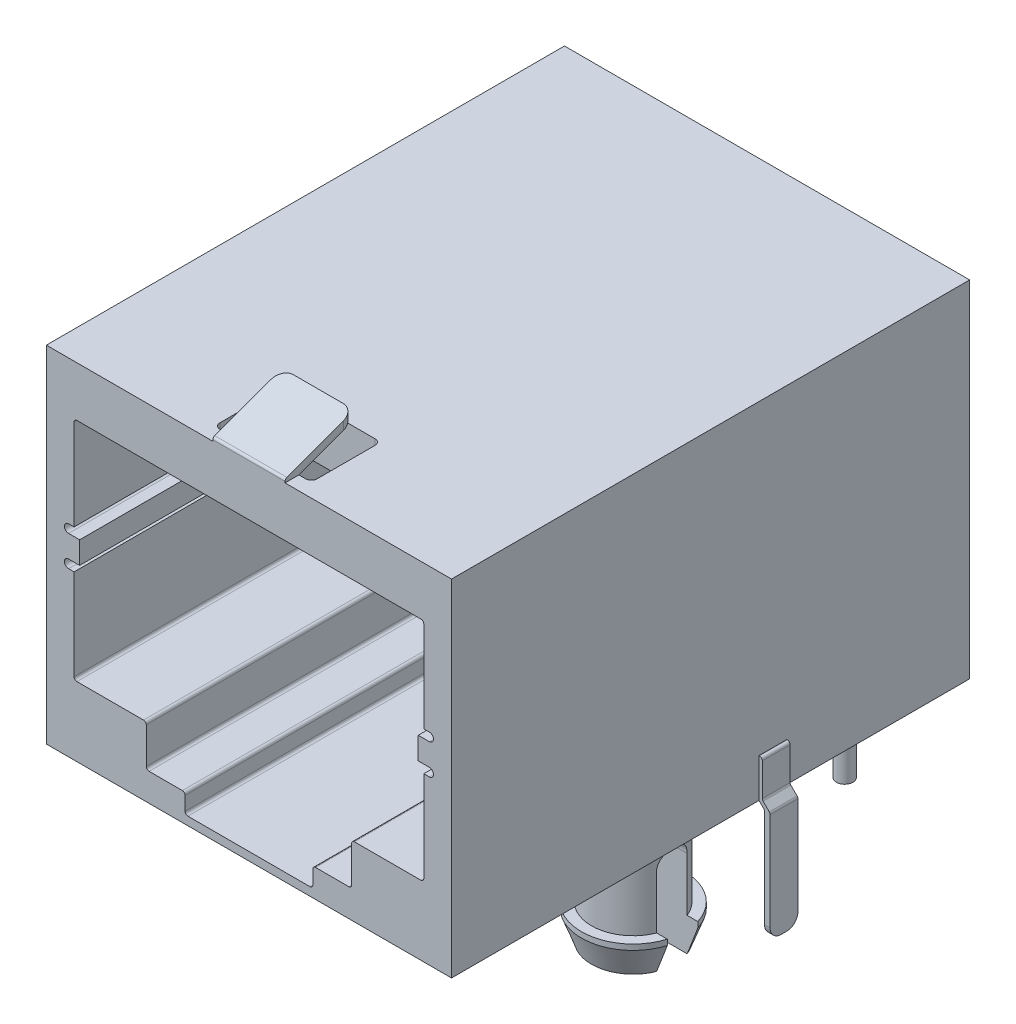
from build123d import *

# Parameters (mm, degrees)
RESSALTO_EXTRUS_O1_DEPTH           = 9.335
RESSALTO_EXTRUS_O1_DEPTH_BACK      = 9.335
ESBO_O1_W                          = 14.6
ESBO_O1_H                          = 12.45
CORTE_EXTRUS_O1_DEPTH              = 13
ESBO_O3_R                          = 1.5
ESBO_O3_R_2                        = 0.3
RESSALTO_EXTRUS_O2_DEPTH           = 3.68
ESBO_O4_R                          = 1.5
RESSALTO_EXTRUS_O3_DEPTH           = 1
RESSALTO_EXTRUS_O3_DRAFT           = 20
RESSALTO_EXTRUS_O3_PROFILE_2_DEPTH = 1
RESSALTO_EXTRUS_O3_PROFILE_2_DRAFT = 20
ESBO_O5_R                          = 1.863970234
RESSALTO_EXTRUS_O4_DEPTH           = 0.2
ESBO_O7_W                          = 1.3
ESBO_O7_H                          = 4.5
ESBO_O7_H_2                        = 0.866927726
RESSALTO_EXTRUS_O5_DEPTH           = 0.5
CORTE_EXTRUS_O2_DEPTH              = 22.822659788
CORTE_EXTRUS_O2_DEPTH_BACK         = 22.822659788
RESSALTO_EXTRUS_O6_DEPTH           = 0.5
RESSALTO_EXTRUS_O6_DEPTH_BACK      = 0.5
FILETE1_R                          = 0.4
ESBO_O11_W                         = 0.5
ESBO_O11_H                         = 4.075
RESSALTO_EXTRUS_O7_DEPTH           = 3
CHANFRO1_SIZE                      = 2
CORTE_EXTRUS_O3_REACH              = 22.567
RESSALTO_EXTRUS_O8_DEPTH           = 1.3
RESSALTO_EXTRUS_O8_DEPTH_BACK      = 1.3
FILETE2_R                          = 0.4


with BuildPart() as part:
    # Esboço1 → Ressalto-extrusão1 (new, two sides: drawn at the far end of the back side and taken through both)
    with BuildSketch(Plane.XY.offset(-RESSALTO_EXTRUS_O1_DEPTH_BACK)):
        with Locations((0, 6.725)):
            Rectangle(ESBO_O1_W, ESBO_O1_H)
    extrude(amount=RESSALTO_EXTRUS_O1_DEPTH + RESSALTO_EXTRUS_O1_DEPTH_BACK)

    # Esboço2 → Corte-extrusão1 (cut)
    with BuildSketch(Plane.XY.offset(9.335)):
        with BuildLine():
            Line((6.2, 11.15), (-6.2, 11.15))
            ThreePointArc((-6.2, 11.15), (-6.270710678, 11.120710678), (-6.3, 11.05))
            Line((-6.3, 11.05), (-6.3, 7.775))
            Line((-6.3, 7.775), (-6.5, 7.775))
            ThreePointArc((-6.5, 7.775), (-6.65, 7.625), (-6.5, 7.475))
            Line((-6.5, 7.475), (-6.1, 7.475))
            Line((-6.1, 7.475), (-6.1, 6.675))
            Line((-6.1, 6.675), (-6.5, 6.675))
            ThreePointArc((-6.5, 6.675), (-6.65, 6.525), (-6.5, 6.375))
            Line((-6.5, 6.375), (-6.3, 6.375))
            Line((-6.3, 6.375), (-6.3, 3.1))
            ThreePointArc((-6.3, 3.1), (-6.270710678, 3.029289322), (-6.2, 3))
            Line((-6.2, 3), (-3.8, 3))
            ThreePointArc((-3.8, 3), (-3.729289322, 2.970710678), (-3.7, 2.9))
            Line((-3.7, 2.9), (-3.7, 1.6))
            ThreePointArc((-3.7, 1.6), (-3.670710678, 1.529289322), (-3.6, 1.5))
            Line((-3.6, 1.5), (-2.4, 1.5))
            ThreePointArc((-2.4, 1.5), (-2.329289322, 1.470710678), (-2.3, 1.4))
            Line((-2.3, 1.4), (-2.3, 0.9))
            ThreePointArc((-2.3, 0.9), (-2.270710678, 0.829289322), (-2.2, 0.8))
            Line((-2.2, 0.8), (2.2, 0.8))
            ThreePointArc((2.2, 0.8), (2.270710678, 0.829289322), (2.3, 0.9))
            Line((2.3, 0.9), (2.3, 1.4))
            ThreePointArc((2.3, 1.4), (2.329289322, 1.470710678), (2.4, 1.5))
            Line((2.4, 1.5), (3.6, 1.5))
            ThreePointArc((3.6, 1.5), (3.670710678, 1.529289322), (3.7, 1.6))
            Line((3.7, 1.6), (3.7, 2.9))
            ThreePointArc((3.7, 2.9), (3.729289322, 2.970710678), (3.8, 3))
            Line((3.8, 3), (6.2, 3))
            ThreePointArc((6.2, 3), (6.270710678, 3.029289322), (6.3, 3.1))
            Line((6.3, 3.1), (6.3, 6.375))
            Line((6.3, 6.375), (6.5, 6.375))
            ThreePointArc((6.5, 6.375), (6.65, 6.525), (6.5, 6.675))
            Line((6.5, 6.675), (6.1, 6.675))
            Line((6.1, 6.675), (6.1, 7.475))
            Line((6.1, 7.475), (6.5, 7.475))
            ThreePointArc((6.5, 7.475), (6.65, 7.625), (6.5, 7.775))
            Line((6.5, 7.775), (6.3, 7.775))
            Line((6.3, 7.775), (6.3, 11.05))
            ThreePointArc((6.3, 11.05), (6.270710678, 11.120710678), (6.2, 11.15))
        make_face()
    extrude(amount=-CORTE_EXTRUS_O1_DEPTH, mode=Mode.SUBTRACT)

    # Esboço3 → Ressalto-extrusão2 (add)
    with BuildSketch(Plane.XZ.offset(-0.5)):
        with Locations((-5.715, 1.205)):
            Circle(ESBO_O3_R)
        with Locations((-4.445, -5.145)):
            Circle(ESBO_O3_R_2)
        with Locations((-3.175, -7.685)):
            Circle(ESBO_O3_R_2)
        with Locations((5.715, 1.205)):
            Circle(ESBO_O3_R)
        with Locations((-1.905, -5.145)):
            Circle(ESBO_O3_R_2)
        with Locations((-0.635, -7.685)):
            Circle(ESBO_O3_R_2)
        with Locations((0.635, -5.145)):
            Circle(ESBO_O3_R_2)
        with Locations((1.905, -7.685)):
            Circle(ESBO_O3_R_2)
        with Locations((3.175, -5.145)):
            Circle(ESBO_O3_R_2)
        with Locations((4.445, -7.685)):
            Circle(ESBO_O3_R_2)
    extrude(amount=RESSALTO_EXTRUS_O2_DEPTH)


with BuildPart() as ressalto_extrus_o3_tool:
    # Esboço4 → Ressalto-extrusão3 (with draft: the straight prism first)
    with BuildSketch(Plane.XZ.offset(3.18)):
        with Locations((-5.715, 1.205)):
            Circle(ESBO_O4_R)
    extrude(amount=-RESSALTO_EXTRUS_O3_DEPTH)
    # Ressalto-extrusão3: the draft: its side faces are tilted about the plane it starts from
    ressalto_extrus_o3_sides = [ressalto_extrus_o3_tool.faces().sort_by_distance(p)[0] for p in [
        (-7.215, -2.68, 1.205),
    ]]
    draft(ressalto_extrus_o3_sides, Plane.XZ.offset(3.18), RESSALTO_EXTRUS_O3_DRAFT)


with BuildPart() as part_1:
    add(part.part)

    # Ressalto-extrusão3: add ressalto_extrus_o3_tool
    add(ressalto_extrus_o3_tool.part)


with BuildPart() as ressalto_extrus_o3_profile_2_tool:
    # Esboço4 → Ressalto-extrusão3 profile 2 (with draft: the straight prism first)
    with BuildSketch(Plane.XZ.offset(3.18)):
        with Locations((5.715, 1.205)):
            Circle(ESBO_O4_R)
    extrude(amount=-RESSALTO_EXTRUS_O3_PROFILE_2_DEPTH)
    # Ressalto-extrusão3 profile 2: the draft: its side faces are tilted about the plane it starts from
    ressalto_extrus_o3_profile_2_sides = [ressalto_extrus_o3_profile_2_tool.faces().sort_by_distance(p)[0] for p in [
        (4.215, -2.68, 1.205),
    ]]
    draft(ressalto_extrus_o3_profile_2_sides, Plane.XZ.offset(3.18), RESSALTO_EXTRUS_O3_PROFILE_2_DRAFT)


with BuildPart() as part_2:
    add(part_1.part)

    # Ressalto-extrusão3 profile 2: add ressalto_extrus_o3_profile_2_tool
    add(ressalto_extrus_o3_profile_2_tool.part)

    # Esboço5 → Ressalto-extrusão4 (add)
    with BuildSketch(Plane(origin=(0, -2.18, 0), x_dir=(1, 0, 0), z_dir=(0, 1, 0))):
        with Locations((-5.715, -1.205)):
            Circle(ESBO_O5_R)
        with Locations((5.715, -1.205)):
            Circle(ESBO_O5_R)
    extrude(amount=RESSALTO_EXTRUS_O4_DEPTH)

    # Esboço7 → Ressalto-extrusão5 (add)
    with BuildSketch(Plane.XZ.offset(-0.5)):
        with Locations((-3.175, 4.902153743)):
            Rectangle(ESBO_O7_W, ESBO_O7_H)
        with Locations((-3.175, -8.712623651)):
            Rectangle(ESBO_O7_W, ESBO_O7_H_2)
        with Locations((3.175, -8.712623651)):
            Rectangle(ESBO_O7_W, ESBO_O7_H_2)
        with Locations((3.175, 4.902153743)):
            Rectangle(ESBO_O7_W, ESBO_O7_H)
    extrude(amount=RESSALTO_EXTRUS_O5_DEPTH)

    # Esboço8 → Corte-extrusão2 (cut, two sides: drawn at the far end of the back side and taken through both)
    with BuildSketch(Plane(origin=(7.3, 0, 0), x_dir=(0, 0, -1), z_dir=(1, 0, 0)).offset(-CORTE_EXTRUS_O2_DEPTH_BACK)):
        with BuildLine():
            Line((-1.755, -0.05), (-1.755, -3.18))
            Line((-1.755, -3.18), (-0.655, -3.18))
            Line((-0.655, -3.18), (-0.655, -0.05))
            ThreePointArc((-0.655, -0.05), (-1.205, 0.5), (-1.755, -0.05))
        make_face()
    extrude(amount=CORTE_EXTRUS_O2_DEPTH + CORTE_EXTRUS_O2_DEPTH_BACK, mode=Mode.SUBTRACT)

    # Esboço9 → Ressalto-extrusão6 (add, two sides: drawn at the far end of the back side and taken through both)
    with BuildSketch(Plane.XY.offset(-2.245).offset(-RESSALTO_EXTRUS_O6_DEPTH_BACK)):
        with BuildLine():
            Line((-7.3, 1.9), (-7.32, 1.9))
            ThreePointArc((-7.32, 1.9), (-7.390710678, 1.870710678), (-7.42, 1.8))
            Line((-7.42, 1.8), (-7.42, 0.621421356))
            ThreePointArc((-7.42, 0.621421356), (-7.427612047, 0.583153013), (-7.449289322, 0.550710678))
            Line((-7.449289322, 0.550710678), (-7.670710678, 0.329289322))
            ThreePointArc((-7.670710678, 0.329289322), (-7.692387953, 0.296846987), (-7.7, 0.258578644))
            Line((-7.7, 0.258578644), (-7.7, -3.68))
            Line((-7.7, -3.68), (-7.5, -3.68))
            Line((-7.5, -3.68), (-7.5, 0.258578644))
            ThreePointArc((-7.5, 0.258578644), (-7.492387953, 0.296846987), (-7.470710678, 0.329289322))
            Line((-7.470710678, 0.329289322), (-7.3, 0.5))
            Line((-7.3, 0.5), (-7.3, 1.9))
        make_face()
        with BuildLine():
            Line((7.3, 1.9), (7.3, 0.5))
            Line((7.3, 0.5), (7.470710678, 0.329289322))
            ThreePointArc((7.470710678, 0.329289322), (7.492387953, 0.296846987), (7.5, 0.258578644))
            Line((7.5, 0.258578644), (7.5, -3.68))
            Line((7.5, -3.68), (7.7, -3.68))
            Line((7.7, -3.68), (7.7, 0.258578644))
            ThreePointArc((7.7, 0.258578644), (7.692387953, 0.296846987), (7.670710678, 0.329289322))
            Line((7.670710678, 0.329289322), (7.449289322, 0.550710678))
            ThreePointArc((7.449289322, 0.550710678), (7.427612047, 0.583153013), (7.42, 0.621421356))
            Line((7.42, 0.621421356), (7.42, 1.8))
            ThreePointArc((7.42, 1.8), (7.390710678, 1.870710678), (7.32, 1.9))
            Line((7.32, 1.9), (7.3, 1.9))
        make_face()
    extrude(amount=RESSALTO_EXTRUS_O6_DEPTH + RESSALTO_EXTRUS_O6_DEPTH_BACK)

    # Filete1
    filete1_edges = [part_2.edges().sort_by_distance(p)[0] for p in [
        (-7.6, -3.68, -1.745),
        (-7.6, -3.68, -2.745),
        (7.6, -3.68, -2.745),
        (7.6, -3.68, -1.745),
    ]]
    fillet(filete1_edges, radius=FILETE1_R)

    # Esboço11 → Ressalto-extrusão7 (add)
    with BuildSketch(Plane.XY.offset(-3.665)):
        with Locations((-0.5, 9.1125)):
            Rectangle(ESBO_O11_W, ESBO_O11_H)
        with Locations((0.5, 9.1125)):
            Rectangle(ESBO_O11_W, ESBO_O11_H)
        with Locations((1.5, 9.1125)):
            Rectangle(ESBO_O11_W, ESBO_O11_H)
        with Locations((2.5, 9.1125)):
            Rectangle(ESBO_O11_W, ESBO_O11_H)
        with Locations((3.5, 9.1125)):
            Rectangle(ESBO_O11_W, ESBO_O11_H)
        with Locations((-1.5, 9.1125)):
            Rectangle(ESBO_O11_W, ESBO_O11_H)
        with Locations((-2.5, 9.1125)):
            Rectangle(ESBO_O11_W, ESBO_O11_H)
        with Locations((-3.5, 9.1125)):
            Rectangle(ESBO_O11_W, ESBO_O11_H)
    extrude(amount=RESSALTO_EXTRUS_O7_DEPTH)

    # Chanfro1
    chanfro1_edges = [part_2.edges().sort_by_distance(p)[0] for p in [
        (3.5, 7.075, -0.665),
        (2.5, 7.075, -0.665),
        (1.5, 7.075, -0.665),
        (0.5, 7.075, -0.665),
        (-0.5, 7.075, -0.665),
        (-1.5, 7.075, -0.665),
        (-2.5, 7.075, -0.665),
        (-3.5, 7.075, -0.665),
    ]]
    chamfer(chanfro1_edges, length=CHANFRO1_SIZE)

    # Esboço12 → Corte-extrusão3 (cut, up to next)
    with BuildSketch(Plane(origin=(0, 12.95, 0), x_dir=(1, 0, 0), z_dir=(0, 1, 0)), mode=Mode.PRIVATE) as corte_extrus_o3_sk1:
        with BuildLine():
            Line((-1.55, -6.335), (1.55, -6.335))
            ThreePointArc((1.55, -6.335), (1.691421356, -6.393578644), (1.75, -6.535))
            Line((1.75, -6.535), (1.75, -8.635))
            ThreePointArc((1.75, -8.635), (1.691421356, -8.776421356), (1.55, -8.835))
            Line((1.55, -8.835), (-1.55, -8.835))
            ThreePointArc((-1.55, -8.835), (-1.691421356, -8.776421356), (-1.75, -8.635))
            Line((-1.75, -8.635), (-1.75, -6.535))
            ThreePointArc((-1.75, -6.535), (-1.691421356, -6.393578644), (-1.55, -6.335))
        make_face()
    corte_extrus_o3_tool1 = extrude(corte_extrus_o3_sk1.sketch, amount=-CORTE_EXTRUS_O3_REACH, mode=Mode.PRIVATE) & part_2.part
    add(corte_extrus_o3_tool1.solids().sort_by_distance((0, 12.95, 7.585))[0], mode=Mode.SUBTRACT)

    # Esboço13 → Ressalto-extrusão8 (add, two sides: drawn at the far end of the back side and taken through both)
    with BuildSketch(Plane(origin=(0, 0, 0), x_dir=(0, 0, -1), z_dir=(1, 0, 0)).offset(-RESSALTO_EXTRUS_O8_DEPTH_BACK)):
        with BuildLine():
            Line((-9.269202014, 13.091963391), (-6.835, 13.977940469))
            Line((-6.835, 13.977940469), (-6.835, 13.677940469))
            Line((-6.835, 13.677940469), (-8.835, 12.95))
            Line((-8.835, 12.95), (-9.335, 12.95))
            Line((-9.335, 12.95), (-9.335, 12.997994129))
            ThreePointArc((-9.335, 12.997994129), (-9.316915204, 13.055351773), (-9.269202014, 13.091963391))
        make_face()
    extrude(amount=RESSALTO_EXTRUS_O8_DEPTH + RESSALTO_EXTRUS_O8_DEPTH_BACK)

    # Filete2
    filete2_edges = [part_2.edges().sort_by_distance(p)[0] for p in [
        (-1.3, 13.827940469, 6.835),
        (1.3, 13.827940469, 6.835),
    ]]
    fillet(filete2_edges, radius=FILETE2_R)


solid = part_2.part
